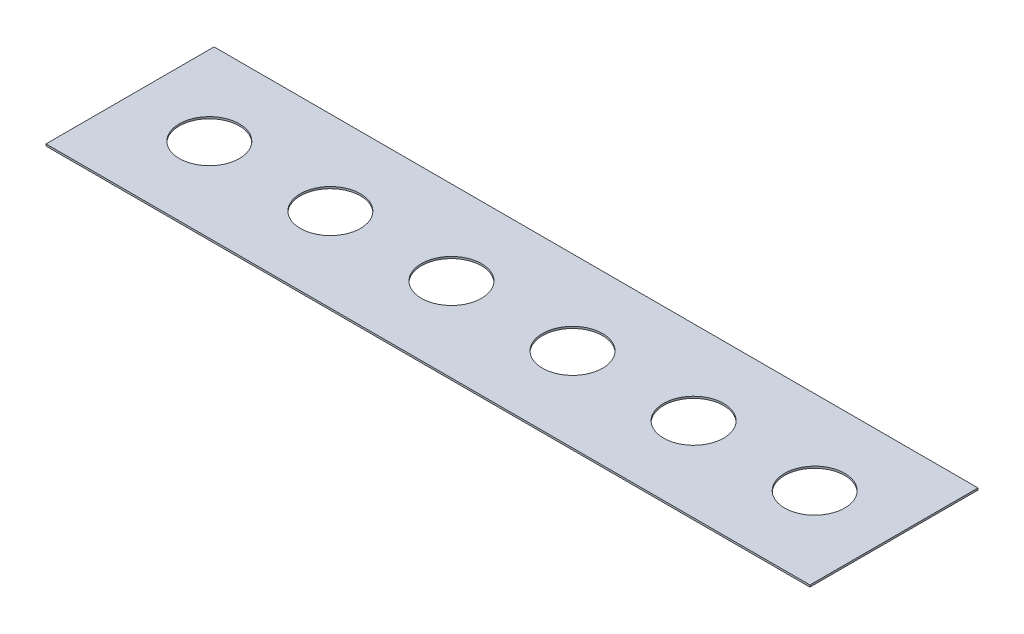
from build123d import *

# Parameters (mm, degrees)
SKETCH1_W           = 635
SKETCH1_H           = 139.7
SKETCH1_R           = 24.9936
BOSS_EXTRUDE1_DEPTH = 1.5748


with BuildPart() as part:
    # Sketch1 → Boss-Extrude1 (new body)
    with BuildSketch(Plane(origin=(0, 0, 0), x_dir=(1, 0, 0), z_dir=(0, 1, 0))):
        Rectangle(SKETCH1_W, SKETCH1_H)
        with Locations(Location((-251.587, 0, 0), (0, 0, 270))):
            Circle(SKETCH1_R, mode=Mode.SUBTRACT)
        with Locations(Location((-150.9522, 0, 0), (0, 0, 270))):
            Circle(SKETCH1_R, mode=Mode.SUBTRACT)
        with Locations(Location((-50.3174, 0, 0), (0, 0, 270))):
            Circle(SKETCH1_R, mode=Mode.SUBTRACT)
        with Locations(Location((50.3174, 0, 0), (0, 0, 270))):
            Circle(SKETCH1_R, mode=Mode.SUBTRACT)
        with Locations(Location((150.9522, 0, 0), (0, 0, 270))):
            Circle(SKETCH1_R, mode=Mode.SUBTRACT)
        with Locations(Location((251.587, 0, 0), (0, 0, 270))):
            Circle(SKETCH1_R, mode=Mode.SUBTRACT)
    extrude(amount=BOSS_EXTRUDE1_DEPTH)


solid = part.part
